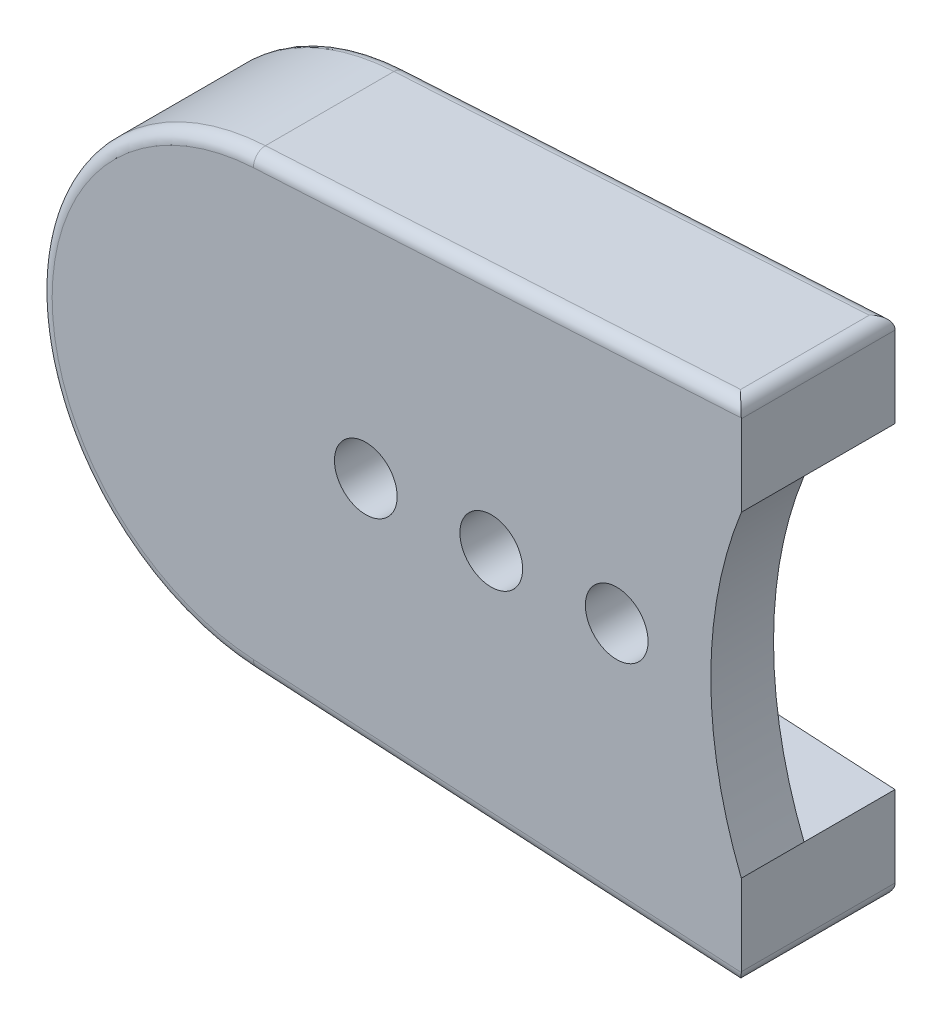
from build123d import *

# Parameters (mm, degrees)
SKETCH_1_R      = 0.5
EXTRUDE_1_DEPTH = 1
EXTRUDE_START   = -2.45
EXTRUDE_2_DEPTH = 2.45
FILLET_1_R      = 0.2


with BuildPart() as part:
    # 草图1 → 凸台-拉伸1 (new body)
    with BuildSketch(Plane.XY):
        with BuildLine():
            Line((-14.016792693, -2.096749739), (-6.313489141, -2.525837459))
            ThreePointArc((-6.313489141, -2.525837459), (-6.8, 0), (-6.313489141, 2.525837459))
            Line((-6.313489141, 2.525837459), (-14.016792693, 2.096749739))
            ThreePointArc((-14.016792693, 2.096749739), (-16, 0), (-14.016792693, -2.096749739))
        make_face()
        with Locations((-10.3, 0)):
            Circle(SKETCH_1_R, mode=Mode.SUBTRACT)
        with Locations((-8.3, 0)):
            Circle(SKETCH_1_R, mode=Mode.SUBTRACT)
        with Locations((-12.3, 0)):
            Circle(SKETCH_1_R, mode=Mode.SUBTRACT)
    extrude(amount=EXTRUDE_1_DEPTH)

    # 草图3 → 凸台-拉伸2 (add)
    with BuildSketch(Plane.XY.offset(1).offset(EXTRUDE_START)):
        with BuildLine():
            Line((-6.313489141, 4.028162673), (-14.100216045, 3.594428124))
            ThreePointArc((-14.100216045, 3.594428124), (-17.5, 0), (-14.100216045, -3.594428124))
            Line((-14.100216045, -3.594428124), (-6.313489141, -4.028162673))
            Line((-6.313489141, -4.028162673), (-6.313489141, -2.525837459))
            Line((-6.313489141, -2.525837459), (-14.016792693, -2.096749739))
            ThreePointArc((-14.016792693, -2.096749739), (-16, 0), (-14.016792693, 2.096749739))
            Line((-14.016792693, 2.096749739), (-6.313489141, 2.525837459))
            Line((-6.313489141, 2.525837459), (-6.313489141, 4.028162673))
        make_face()
    extrude(amount=EXTRUDE_2_DEPTH)

    # 圆角1
    fillet_1_edges = [part.edges().sort_by_distance(p)[0] for p in [
        (-10.206852593, 3.811295398, 1),
        (-17.5, 0, 1),
        (-10.206852593, -3.811295398, 1),
        (-17.5, 0, -1.45),
        (-10.206852593, -3.811295398, -1.45),
        (-6.313489141, -4.028162673, -0.225),
        (-6.313489141, 4.028162673, -0.225),
        (-10.206852593, 3.811295398, -1.45),
    ]]
    fillet(fillet_1_edges, radius=FILLET_1_R)


solid = part.part
